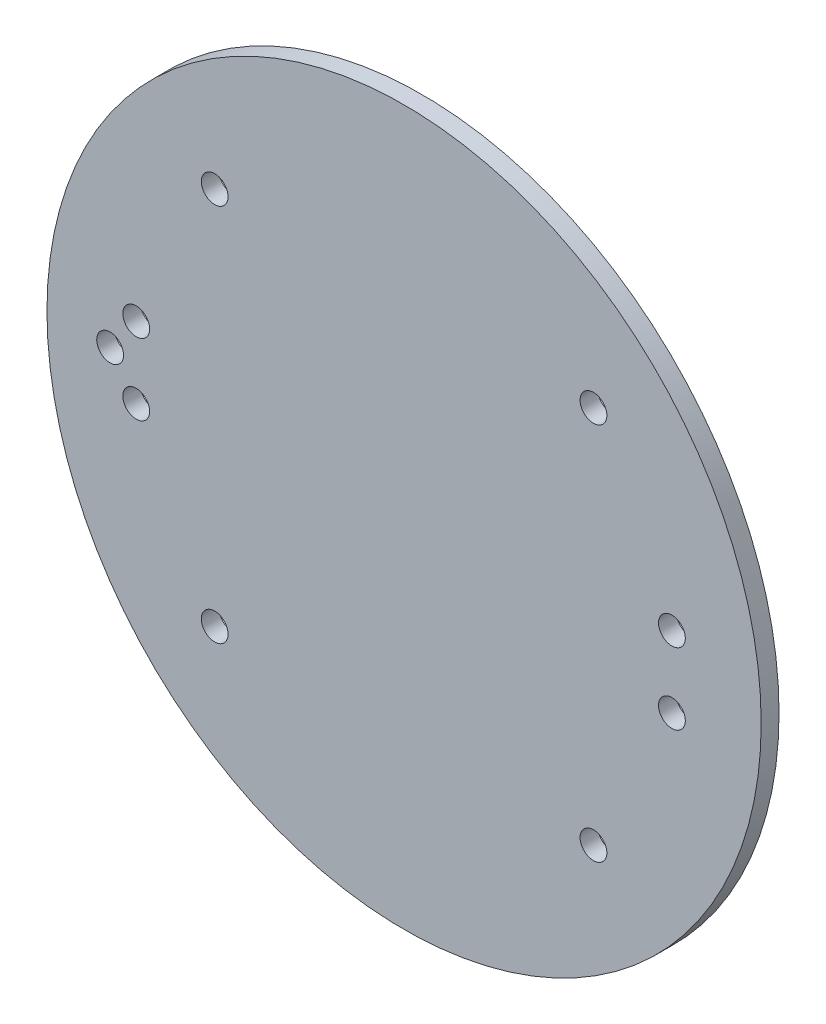
from build123d import *

# Parameters (mm, degrees)
SKETCH1_R               = 127
BOSS_EXTRUDE1_DEPTH     = 6.35
CUT_EXTRUDE1_DEPTH      = 180.717340566
CUT_EXTRUDE1_DEPTH_BACK = 180.717340566
SKETCH2_R               = 4.7625
CUT_EXTRUDE2_DEPTH      = 180.717340566
CUT_EXTRUDE2_DEPTH_BACK = 180.717340566
SKETCH3_R               = 4.7625
CUT_EXTRUDE4_DEPTH      = 180.717340566
CUT_EXTRUDE4_DEPTH_BACK = 180.717340566
SKETCH4_R               = 4.7625


with BuildPart() as part:
    # Sketch1 → Boss-Extrude1 (new body)
    with BuildSketch(Plane.XY):
        Circle(SKETCH1_R)
    extrude(amount=BOSS_EXTRUDE1_DEPTH)

    # Sketch2 → Cut-Extrude1 (cut, two sides: drawn at the far end of the back side and taken through both)
    with BuildSketch(Plane.XY.offset(6.35).offset(-CUT_EXTRUDE1_DEPTH_BACK)):
        with Locations((-67.351920908, 67.351920908)):
            Circle(SKETCH2_R)
        with Locations((-67.351920908, -67.351920908)):
            Circle(SKETCH2_R)
        with Locations((67.351920908, -67.351920908)):
            Circle(SKETCH2_R)
        with Locations((67.351920908, 67.351920908)):
            Circle(SKETCH2_R)
    extrude(amount=CUT_EXTRUDE1_DEPTH + CUT_EXTRUDE1_DEPTH_BACK, mode=Mode.SUBTRACT)

    # Sketch3 → Cut-Extrude2 (cut, two sides: drawn at the far end of the back side and taken through both)
    with BuildSketch(Plane.XY.offset(6.35).offset(-CUT_EXTRUDE2_DEPTH_BACK)):
        with Locations((-95.25, 12.7)):
            Circle(SKETCH3_R)
        with Locations((-95.25, -12.7)):
            Circle(SKETCH3_R)
        with Locations((95.25, -12.7)):
            Circle(SKETCH3_R)
        with Locations((95.25, 12.7)):
            Circle(SKETCH3_R)
    extrude(amount=CUT_EXTRUDE2_DEPTH + CUT_EXTRUDE2_DEPTH_BACK, mode=Mode.SUBTRACT)

    # Sketch4 → Cut-Extrude4 (cut, two sides: drawn at the far end of the back side and taken through both)
    with BuildSketch(Plane.XY.offset(6.35).offset(-CUT_EXTRUDE4_DEPTH_BACK)):
        with Locations((-104.537500094, 0)):
            Circle(SKETCH4_R)
    extrude(amount=CUT_EXTRUDE4_DEPTH + CUT_EXTRUDE4_DEPTH_BACK, mode=Mode.SUBTRACT)


solid = part.part
